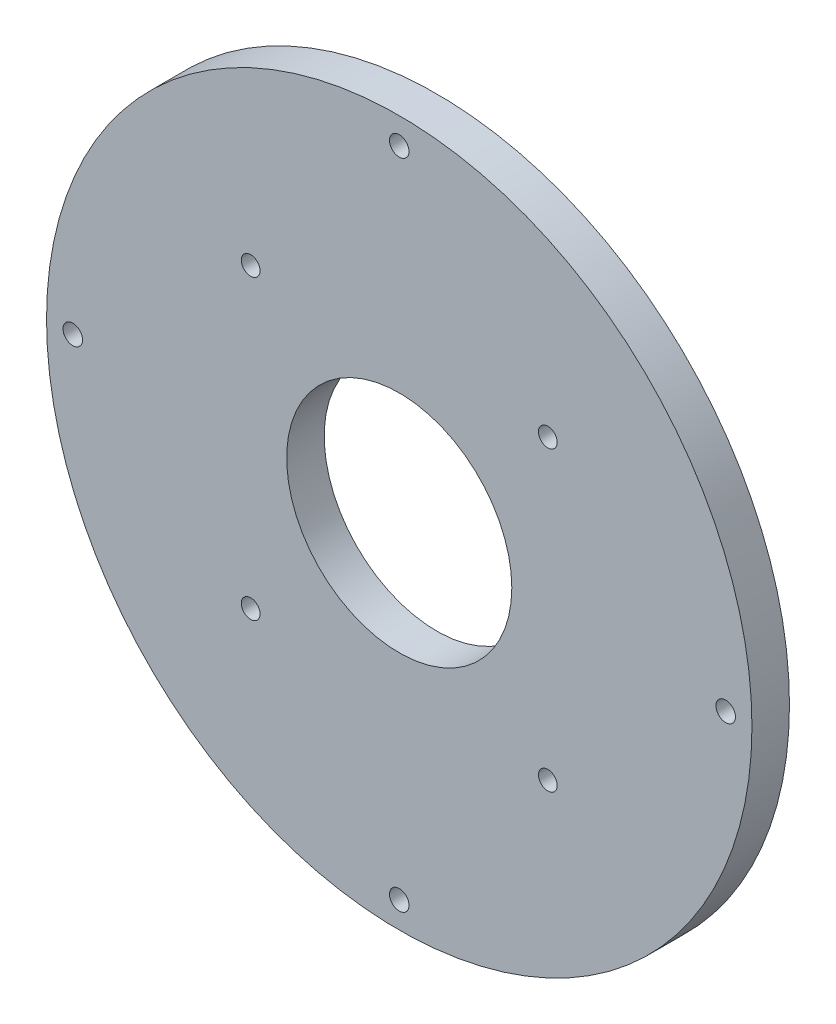
from build123d import *

# Parameters (mm, degrees)
SKETCH1_R           = 47
SKETCH1_R_2         = 1.3
SKETCH1_R_3         = 15
SKETCH1_R_4         = 1.25
BOSS_EXTRUDE1_DEPTH = 5


with BuildPart() as part:
    # Sketch1 → Boss-Extrude1 (new body)
    with BuildSketch(Plane.XY):
        Circle(SKETCH1_R)
        with Locations((0, 43.5)):
            Circle(SKETCH1_R_2, mode=Mode.SUBTRACT)
        with Locations((43.5, 0)):
            Circle(SKETCH1_R_2, mode=Mode.SUBTRACT)
        with Locations((0, -43.5)):
            Circle(SKETCH1_R_2, mode=Mode.SUBTRACT)
        with Locations((-43.5, 0)):
            Circle(SKETCH1_R_2, mode=Mode.SUBTRACT)
        Circle(SKETCH1_R_3, mode=Mode.SUBTRACT)
        with Locations((-19.798989873, 19.798989873)):
            Circle(SKETCH1_R_4, mode=Mode.SUBTRACT)
        with Locations((19.798989873, 19.798989873)):
            Circle(SKETCH1_R_4, mode=Mode.SUBTRACT)
        with Locations((19.798989873, -19.798989873)):
            Circle(SKETCH1_R_4, mode=Mode.SUBTRACT)
        with Locations((-19.798989873, -19.798989873)):
            Circle(SKETCH1_R_4, mode=Mode.SUBTRACT)
    extrude(amount=BOSS_EXTRUDE1_DEPTH)


solid = part.part
